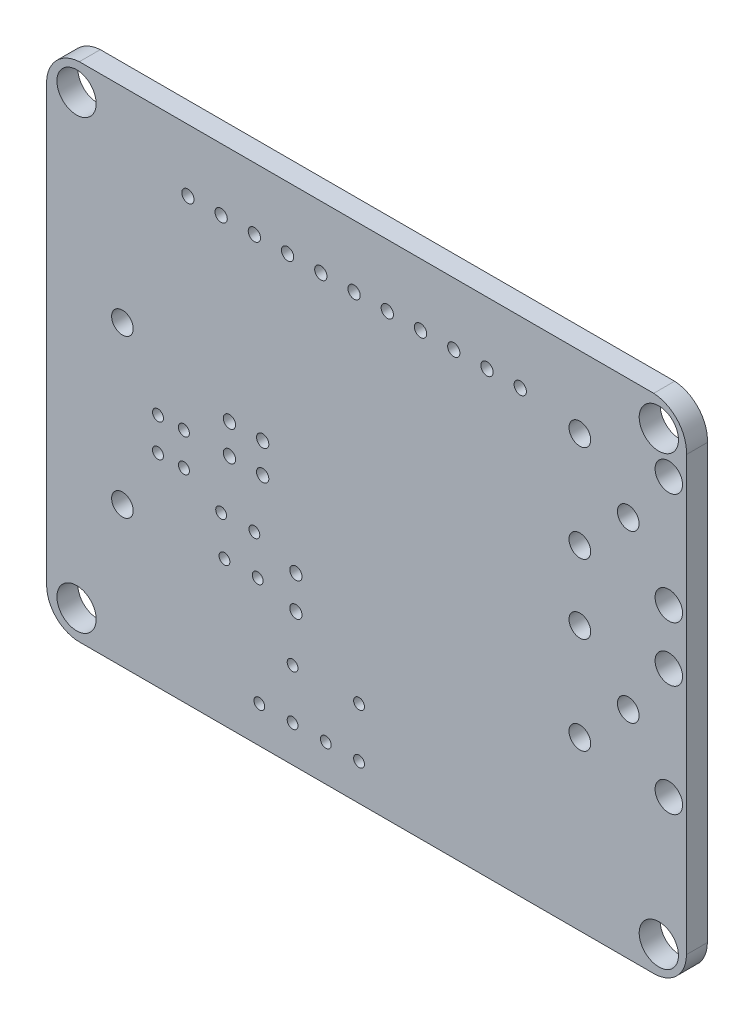
from build123d import *

# Parameters (mm, degrees)
SKETCH_20_R         = 1.5
SKETCH_20_R_2       = 1.05
BOSS_EXTRUDE1_DEPTH = 1.6
SKETCH_17_R         = 0.8255
SKETCH_17_R_2       = 0.4191
SKETCH_17_R_3       = 0.41275
SKETCH_17_R_4       = 0.4699
SKETCH_17_R_5       = 0.829
CUT_EXTRUDE1_DEPTH  = 1.6


with BuildPart() as part:
    # Sketch 20 → Boss-Extrude1 (new body)
    with BuildSketch(Plane.XY):
        with BuildLine():
            Line((50.205, 38.4048), (6.31, 38.4048))
            ThreePointArc((6.31, 38.4048), (4.47911474, 37.520159965), (3.81, 35.6))
            Line((3.81, 35.6), (3.81, 2.5))
            ThreePointArc((3.81, 2.5), (4.542233047, 0.732233047), (6.31, 0))
            Line((6.31, 0), (50.205, 0))
            ThreePointArc((50.205, 0), (51.972766953, 0.732233047), (52.705, 2.5))
            Line((52.705, 2.5), (52.705, 35.6))
            ThreePointArc((52.705, 35.6), (52.03588526, 37.520159965), (50.205, 38.4048))
        make_face()
        with Locations((6.096, 2.1336)):
            Circle(SKETCH_20_R, mode=Mode.SUBTRACT)
        with Locations((50.5968, 2.1336)):
            Circle(SKETCH_20_R, mode=Mode.SUBTRACT)
        with Locations((50.5968, 36.2712)):
            Circle(SKETCH_20_R, mode=Mode.SUBTRACT)
        with Locations((6.096, 36.2712)):
            Circle(SKETCH_20_R, mode=Mode.SUBTRACT)
        with Locations((51.36, 12.26)):
            Circle(SKETCH_20_R_2, mode=Mode.SUBTRACT)
        with Locations((51.36, 20.76)):
            Circle(SKETCH_20_R_2, mode=Mode.SUBTRACT)
        with Locations((51.36, 24.96)):
            Circle(SKETCH_20_R_2, mode=Mode.SUBTRACT)
        with Locations((51.36, 33.46)):
            Circle(SKETCH_20_R_2, mode=Mode.SUBTRACT)
    extrude(amount=-BOSS_EXTRUDE1_DEPTH)

    # Sketch 17 → Cut-Extrude1 (cut)
    with BuildSketch(Plane.XY):
        with Locations((9.6012, 22.7838)):
            Circle(SKETCH_17_R)
        with Locations((12.319, 18.014)):
            Circle(SKETCH_17_R_2)
        with Locations((14.3002, 18.014)):
            Circle(SKETCH_17_R_2)
        with Locations((9.6012, 10.7442)):
            Circle(SKETCH_17_R)
        with Locations((20.066, 2.794)):
            Circle(SKETCH_17_R_3)
        with Locations((22.606, 2.794)):
            Circle(SKETCH_17_R_3)
        with Locations((25.146, 2.794)):
            Circle(SKETCH_17_R_3)
        with Locations((27.686, 2.794)):
            Circle(SKETCH_17_R_3)
        with Locations((22.606, 6.604)):
            Circle(SKETCH_17_R_3)
        with Locations((27.686, 6.604)):
            Circle(SKETCH_17_R_3)
        with Locations((17.145, 13.97)):
            Circle(SKETCH_17_R_3)
        with Locations((12.319, 15.514)):
            Circle(SKETCH_17_R_2)
        with Locations((14.3002, 15.514)):
            Circle(SKETCH_17_R_2)
        with Locations((14.605, 33.655)):
            Circle(SKETCH_17_R_4)
        with Locations((17.145, 33.655)):
            Circle(SKETCH_17_R_4)
        with Locations((19.685, 33.655)):
            Circle(SKETCH_17_R_4)
        with Locations((22.225, 33.655)):
            Circle(SKETCH_17_R_4)
        with Locations((24.765, 33.655)):
            Circle(SKETCH_17_R_4)
        with Locations((27.305, 33.655)):
            Circle(SKETCH_17_R_4)
        with Locations((29.845, 33.655)):
            Circle(SKETCH_17_R_4)
        with Locations((32.385, 33.655)):
            Circle(SKETCH_17_R_4)
        with Locations((34.925, 33.655)):
            Circle(SKETCH_17_R_4)
        with Locations((37.465, 33.655)):
            Circle(SKETCH_17_R_4)
        with Locations((40.005, 33.655)):
            Circle(SKETCH_17_R_4)
        with Locations((44.56, 32.91)):
            Circle(SKETCH_17_R_5)
        with Locations((48.26, 29.21)):
            Circle(SKETCH_17_R_5)
        with Locations((44.56, 25.51)):
            Circle(SKETCH_17_R_5)
        with Locations((44.56, 20.21)):
            Circle(SKETCH_17_R_5)
        with Locations((48.26, 16.51)):
            Circle(SKETCH_17_R_5)
        with Locations((44.56, 12.81)):
            Circle(SKETCH_17_R_5)
        with Locations((17.78, 20.32)):
            Circle(SKETCH_17_R_4)
        with Locations((17.78, 18.034)):
            Circle(SKETCH_17_R_4)
        with Locations((20.32, 20.32)):
            Circle(SKETCH_17_R_4)
        with Locations((20.32, 18.034)):
            Circle(SKETCH_17_R_4)
        with Locations((17.399, 11.049)):
            Circle(SKETCH_17_R_3)
        with Locations((19.685, 13.97)):
            Circle(SKETCH_17_R_3)
        with Locations((19.939, 11.049)):
            Circle(SKETCH_17_R_3)
        with Locations((22.86, 12.827)):
            Circle(SKETCH_17_R_4)
        with Locations((22.86, 10.287)):
            Circle(SKETCH_17_R_4)
    extrude(amount=-CUT_EXTRUDE1_DEPTH, mode=Mode.SUBTRACT)


solid = part.part
